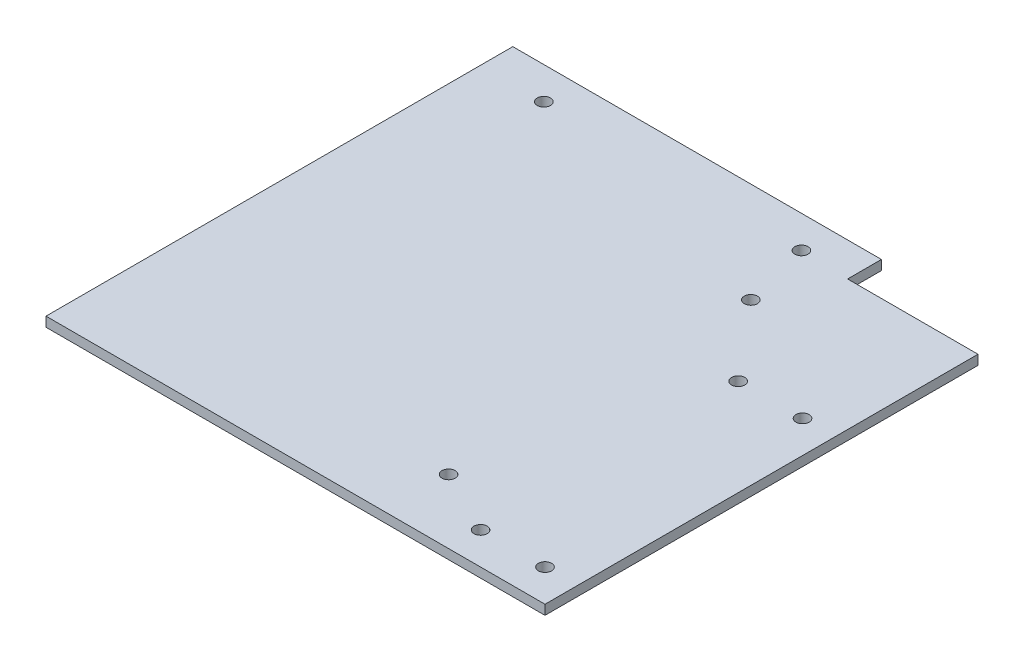
from build123d import *

# Parameters (mm, degrees)
SKETCH2_W           = 155
SKETCH2_H           = 145
BOSS_EXTRUDE1_DEPTH = 3
SKETCH4_W           = 40.5
SKETCH4_H           = 10.5
CUT_EXTRUDE1_DEPTH  = 3
SKETCH5_R           = 2.05
CUT_EXTRUDE2_DEPTH  = 3
SKETCH6_R           = 2.05
CUT_EXTRUDE3_DEPTH  = 3


with BuildPart() as part:
    # Sketch2 → Boss-Extrude1 (new body)
    with BuildSketch(Plane(origin=(0, 0, 0), x_dir=(1, 0, 0), z_dir=(0, 1, 0))):
        Rectangle(SKETCH2_W, SKETCH2_H)
    extrude(amount=BOSS_EXTRUDE1_DEPTH)

    # Sketch4 → Cut-Extrude1 (cut)
    with BuildSketch(Plane(origin=(0, 3, 0), x_dir=(1, 0, 0), z_dir=(0, 1, 0))):
        with Locations((57.25, 67.25)):
            Rectangle(SKETCH4_W, SKETCH4_H)
    extrude(amount=-CUT_EXTRUDE1_DEPTH, mode=Mode.SUBTRACT)

    # Sketch5 → Cut-Extrude2 (cut)
    with BuildSketch(Plane(origin=(0, 3, 0), x_dir=(1, 0, 0), z_dir=(0, 1, 0))):
        with Locations(Location((-57.85, 62.5, 0), (0, 0, 270))):
            Circle(SKETCH5_R)
        with Locations(Location((22.15, 62.5, 0), (0, 0, 270))):
            Circle(SKETCH5_R)
        with Locations(Location((47.5, 17.5, 0), (0, 0, 270))):
            Circle(SKETCH5_R)
        with Locations(Location((67.5, 17.5, 0), (0, 0, 270))):
            Circle(SKETCH5_R)
        with Locations(Location((47.5, -62.5, 0), (0, 0, 270))):
            Circle(SKETCH5_R)
        with Locations(Location((67.5, -62.5, 0), (0, 0, 270))):
            Circle(SKETCH5_R)
    extrude(amount=-CUT_EXTRUDE2_DEPTH, mode=Mode.SUBTRACT)

    # Sketch6 → Cut-Extrude3 (cut)
    with BuildSketch(Plane(origin=(0, 3, 0), x_dir=(1, 0, 0), z_dir=(0, 1, 0))):
        with Locations(Location((27.599633374, -52.545679653, 0), (0, 0, 270))):
            Circle(SKETCH6_R)
        with Locations(Location((27.599633374, 41.341825757, 0), (0, 0, 270))):
            Circle(SKETCH6_R)
    extrude(amount=-CUT_EXTRUDE3_DEPTH, mode=Mode.SUBTRACT)


solid = part.part
